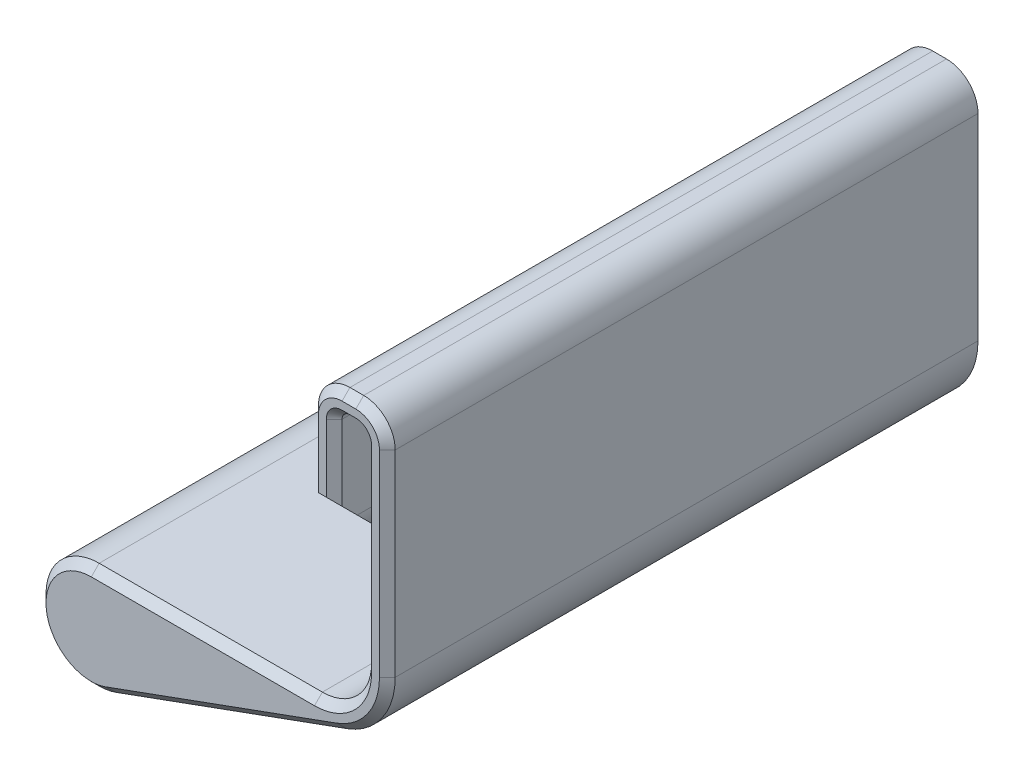
from build123d import *

# Parameters (mm, degrees)
BOSS_EXTRUDE1_DEPTH = 60
CHAMFER2_SIZE       = 0.8
CUT_EXTRUDE1_DEPTH  = 73.196490998
FILLET2_R           = 0.8


with BuildPart() as part:
    # Sketch1 → Boss-Extrude1 (new body)
    with BuildSketch(Plane.XY):
        with BuildLine():
            Line((2.4, 0), (2.4, 9.2))
            ThreePointArc((2.4, 9.2), (2.634314575, 9.765685425), (3.2, 10))
            Line((3.2, 10), (4.6, 10))
            ThreePointArc((4.6, 10), (5.165685425, 9.765685425), (5.4, 9.2))
            Line((5.4, 9.2), (5.4, -10.8))
            ThreePointArc((5.4, -10.8), (3.935533906, -14.335533906), (0.4, -15.8))
            Line((0.4, -15.8), (-22.271467176, -15.8))
            ThreePointArc((-22.271467176, -15.8), (-27.674350112, -21.202882937), (-22.271467176, -26.605765873))
            ThreePointArc((-22.271467176, -26.605765873), (-21.403226287, -26.529804638), (-20.561366459, -26.304228977))
            Line((-20.561366459, -26.304228977), (2.930949061, -17.753725394))
            ThreePointArc((2.930949061, -17.753725394), (6.461725128, -15.044465629), (7.8, -10.8))
            Line((7.8, -10.8), (7.8, 9.2))
            ThreePointArc((7.8, 9.2), (6.8627417, 11.4627417), (4.6, 12.4))
            Line((4.6, 12.4), (3.2, 12.4))
            ThreePointArc((3.2, 12.4), (0.9372583, 11.4627417), (0, 9.2))
            Line((0, 9.2), (0, 0))
            ThreePointArc((0, 0), (-0.121792748, -0.612293492), (-0.46862915, -1.13137085))
            Line((-0.46862915, -1.13137085), (-3.297056275, -3.959797975))
            Line((-3.297056275, -3.959797975), (-1.6, -5.656854249))
            Line((-1.6, -5.656854249), (1.228427125, -2.828427125))
            ThreePointArc((1.228427125, -2.828427125), (2.09551813, -1.530733729), (2.4, 0))
        make_face()
    extrude(amount=BOSS_EXTRUDE1_DEPTH)

    # Chamfer2
    chamfer2_edges = [part.edges().sort_by_distance(p)[0] for p in [
        (-0.185786438, -4.242640687, 60),
        (2.09551813, -1.530733729, 60),
        (2.4, 4.6, 60),
        (2.634314575, 9.765685425, 60),
        (3.9, 10, 60),
        (5.165685425, 9.765685425, 60),
        (5.4, -0.8, 60),
        (3.935533906, -14.335533906, 60),
        (-10.935733588, -15.8, 60),
        (-0.121792748, -0.612293492, 60),
        (-27.674350112, -21.202882937, 60),
        (-21.403226287, -26.529804638, 60),
        (-8.815208699, -22.028977185, 60),
        (6.461725128, -15.044465629, 60),
        (7.8, -0.8, 60),
        (6.8627417, 11.4627417, 60),
        (3.9, 12.4, 60),
        (0.9372583, 11.4627417, 60),
        (0, 4.6, 60),
        (-1.882842712, -2.545584412, 60),
    ]]
    chamfer(chamfer2_edges, length=CHAMFER2_SIZE)

    # Sketch2 → Cut-Extrude1 (cut, through all)
    with BuildSketch(Plane(origin=(2.4, 0, 0), x_dir=(0, 0, -1), z_dir=(1, 0, 0))):
        Polygon((-60, 2.343145751), (-52, -5.656854249), (-60, -5.656854249), align=None)
        Polygon((0, 2.343145751), (-8, -5.656854249), (0, -5.656854249), align=None)
    extrude(amount=-CUT_EXTRUDE1_DEPTH, mode=Mode.SUBTRACT)

    # Fillet2
    fillet2_edges = [part.edges().sort_by_distance(p)[0] for p in [
        (-1.6, -5.656854249, 30),
        (-3.297056275, -3.959797975, 30),
    ]]
    fillet(fillet2_edges, radius=FILLET2_R)


solid = part.part
